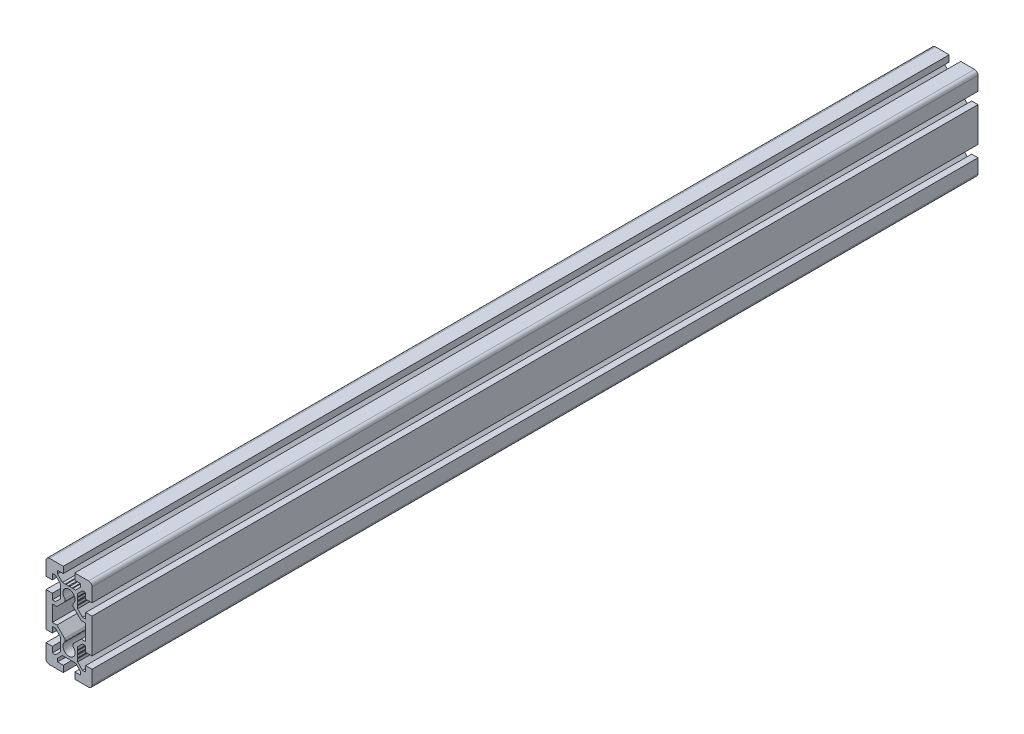
from build123d import *

# Parameters (mm, degrees)
BOSS_EXTRUDE1_DEPTH = 770


with BuildPart() as part:
    # Sketch1 → Boss-Extrude1 (new body)
    with BuildSketch(Plane.XY):
        with BuildLine():
            Line((-14.5, 10), (-14.5, 15))
            Line((-14.5, 15), (-20, 15))
            Line((-20, 15), (-20, -15))
            Line((-20, -15), (-14.5, -15))
            Line((-14.5, -15), (-14.5, -10))
            Line((-14.5, -10), (-11.767766953, -10))
            add(Edge.make_bspline(
                [(-11.767766953, -10), (-10.345177969, -11.422588984), (-8.922588984, -12.845177969), (-7.5, -14.267766953)],
                knots=[0, 0, 0, 0, 1, 1, 1, 1], degree=3))
            Line((-7.5, -14.267766953), (-7.5, -16.653589838))
            Line((-7.5, -16.653589838), (-7.300000072, -16.999999875))
            Line((-7.300000072, -16.999999875), (-7.5, -17.346410162))
            Line((-7.5, -17.346410162), (-7.5, -19.480384758))
            Line((-7.5, -19.480384758), (-7.200000072, -19.999999875))
            Line((-7.200000072, -19.999999875), (-7.5, -20.519615242))
            Line((-7.5, -20.519615242), (-7.5, -22.653589838))
            Line((-7.5, -22.653589838), (-7.3, -23))
            Line((-7.3, -23), (-7.5, -23.346410162))
            Line((-7.5, -23.346410162), (-7.5, -25.732233047))
            add(Edge.make_bspline(
                [(-7.5, -25.732233047), (-8.922588984, -27.154822031), (-10.345177969, -28.577411016), (-11.767766953, -30)],
                knots=[0, 0, 0, 0, 1, 1, 1, 1], degree=3))
            Line((-11.767766953, -30), (-14.5, -30))
            Line((-14.5, -30), (-14.5, -25))
            Line((-14.5, -25), (-20, -25))
            Line((-20, -25), (-20, -37))
            ThreePointArc((-20, -37), (-19.121320344, -39.121320344), (-17, -40))
            Line((-17, -40), (-5, -40))
            Line((-5, -40), (-5, -34.5))
            Line((-5, -34.5), (-10, -34.5))
            Line((-10, -34.5), (-10, -31.767766953))
            add(Edge.make_bspline(
                [(-10, -31.767766953), (-8.577411016, -30.345177969), (-7.154822031, -28.922588984), (-5.732233047, -27.5)],
                knots=[0, 0, 0, 0, 1, 1, 1, 1], degree=3))
            Line((-5.732233047, -27.5), (-3.346410162, -27.5))
            Line((-3.346410162, -27.5), (-3, -27.3))
            Line((-3, -27.3), (-2.653589838, -27.5))
            Line((-2.653589838, -27.5), (-0.519615242, -27.5))
            Line((-0.519615242, -27.5), (-2.17e-07, -27.200000125))
            Line((-2.17e-07, -27.200000125), (0.519615242, -27.5))
            Line((0.519615242, -27.5), (2.653589838, -27.5))
            Line((2.653589838, -27.5), (3, -27.3))
            Line((3, -27.3), (3.346410162, -27.5))
            Line((3.346410162, -27.5), (5.732233047, -27.5))
            add(Edge.make_bspline(
                [(5.732233047, -27.5), (7.154822031, -28.922588984), (8.577411016, -30.345177969), (10, -31.767766953)],
                knots=[0, 0, 0, 0, 1, 1, 1, 1], degree=3))
            Line((10, -31.767766953), (10, -34.5))
            Line((10, -34.5), (5, -34.5))
            Line((5, -34.5), (5, -40))
            Line((5, -40), (17, -40))
            ThreePointArc((17, -40), (19.121320344, -39.121320344), (20, -37))
            Line((20, -37), (20, -25))
            Line((20, -25), (14.5, -25))
            Line((14.5, -25), (14.5, -30))
            Line((14.5, -30), (11.767766953, -30))
            add(Edge.make_bspline(
                [(11.767766953, -30), (10.345177969, -28.577411016), (8.922588984, -27.154822031), (7.5, -25.732233047)],
                knots=[0, 0, 0, 0, 1, 1, 1, 1], degree=3))
            Line((7.5, -25.732233047), (7.5, -23.346410162))
            Line((7.5, -23.346410162), (7.3, -23))
            Line((7.3, -23), (7.5, -22.653589838))
            Line((7.5, -22.653589838), (7.5, -20.519615242))
            Line((7.5, -20.519615242), (7.200000072, -20.000000125))
            Line((7.200000072, -20.000000125), (7.5, -19.480384758))
            Line((7.5, -19.480384758), (7.5, -17.346410162))
            Line((7.5, -17.346410162), (7.300000072, -17.000000125))
            Line((7.300000072, -17.000000125), (7.5, -16.653589838))
            Line((7.5, -16.653589838), (7.5, -14.267766953))
            add(Edge.make_bspline(
                [(7.5, -14.267766953), (8.922588984, -12.845177969), (10.345177969, -11.422588984), (11.767766953, -10)],
                knots=[0, 0, 0, 0, 1, 1, 1, 1], degree=3))
            Line((11.767766953, -10), (14.5, -10))
            Line((14.5, -10), (14.5, -15))
            Line((14.5, -15), (20, -15))
            Line((20, -15), (20, 15))
            Line((20, 15), (14.5, 15))
            Line((14.5, 15), (14.5, 10))
            Line((14.5, 10), (11.767766953, 10))
            add(Edge.make_bspline(
                [(11.767766953, 10), (10.345177969, 11.422588984), (8.922588984, 12.845177969), (7.5, 14.267766953)],
                knots=[0, 0, 0, 0, 1, 1, 1, 1], degree=3))
            Line((7.5, 14.267766953), (7.5, 16.653589838))
            Line((7.5, 16.653589838), (7.300000072, 16.999999875))
            Line((7.300000072, 16.999999875), (7.5, 17.346410162))
            Line((7.5, 17.346410162), (7.5, 19.480384758))
            Line((7.5, 19.480384758), (7.200000072, 19.999999875))
            Line((7.200000072, 19.999999875), (7.5, 20.519615242))
            Line((7.5, 20.519615242), (7.5, 22.653589838))
            Line((7.5, 22.653589838), (7.3, 23))
            Line((7.3, 23), (7.5, 23.346410162))
            Line((7.5, 23.346410162), (7.5, 25.732233047))
            add(Edge.make_bspline(
                [(7.5, 25.732233047), (8.922588984, 27.154822031), (10.345177969, 28.577411016), (11.767766953, 30)],
                knots=[0, 0, 0, 0, 1, 1, 1, 1], degree=3))
            Line((11.767766953, 30), (14.5, 30))
            Line((14.5, 30), (14.5, 25))
            Line((14.5, 25), (20, 25))
            Line((20, 25), (20, 37))
            ThreePointArc((20, 37), (19.121320344, 39.121320344), (17, 40))
            Line((17, 40), (5, 40))
            Line((5, 40), (5, 34.5))
            Line((5, 34.5), (10, 34.5))
            Line((10, 34.5), (10, 31.767766953))
            add(Edge.make_bspline(
                [(10, 31.767766953), (8.577411016, 30.345177969), (7.154822031, 28.922588984), (5.732233047, 27.5)],
                knots=[0, 0, 0, 0, 1, 1, 1, 1], degree=3))
            Line((5.732233047, 27.5), (3.346410162, 27.5))
            Line((3.346410162, 27.5), (3, 27.3))
            Line((3, 27.3), (2.653589838, 27.5))
            Line((2.653589838, 27.5), (0.519615242, 27.5))
            Line((0.519615242, 27.5), (2.17e-07, 27.200000125))
            Line((2.17e-07, 27.200000125), (-0.519615242, 27.5))
            Line((-0.519615242, 27.5), (-2.653589838, 27.5))
            Line((-2.653589838, 27.5), (-3, 27.3))
            Line((-3, 27.3), (-3.346410162, 27.5))
            Line((-3.346410162, 27.5), (-5.732233047, 27.5))
            add(Edge.make_bspline(
                [(-5.732233047, 27.5), (-7.154822031, 28.922588984), (-8.577411016, 30.345177969), (-10, 31.767766953)],
                knots=[0, 0, 0, 0, 1, 1, 1, 1], degree=3))
            Line((-10, 31.767766953), (-10, 34.5))
            Line((-10, 34.5), (-5, 34.5))
            Line((-5, 34.5), (-5, 40))
            Line((-5, 40), (-17, 40))
            ThreePointArc((-17, 40), (-19.121320344, 39.121320344), (-20, 37))
            Line((-20, 37), (-20, 25))
            Line((-20, 25), (-14.5, 25))
            Line((-14.5, 25), (-14.5, 30))
            Line((-14.5, 30), (-11.767766953, 30))
            add(Edge.make_bspline(
                [(-11.767766953, 30), (-10.345177969, 28.577411016), (-8.922588984, 27.154822031), (-7.5, 25.732233047)],
                knots=[0, 0, 0, 0, 1, 1, 1, 1], degree=3))
            Line((-7.5, 25.732233047), (-7.5, 23.346410162))
            Line((-7.5, 23.346410162), (-7.3, 23))
            Line((-7.3, 23), (-7.5, 22.653589838))
            Line((-7.5, 22.653589838), (-7.5, 20.519615242))
            Line((-7.5, 20.519615242), (-7.200000072, 20.000000125))
            Line((-7.200000072, 20.000000125), (-7.5, 19.480384758))
            Line((-7.5, 19.480384758), (-7.5, 17.346410162))
            Line((-7.5, 17.346410162), (-7.300000072, 17.000000125))
            Line((-7.300000072, 17.000000125), (-7.5, 16.653589838))
            Line((-7.5, 16.653589838), (-7.5, 14.267766953))
            add(Edge.make_bspline(
                [(-7.5, 14.267766953), (-8.922588984, 12.845177969), (-10.345177969, 11.422588984), (-11.767766953, 10)],
                knots=[0, 0, 0, 0, 1, 1, 1, 1], degree=3))
            Line((-11.767766953, 10), (-14.5, 10))
        make_face()
        with BuildLine():
            Line((-10.525126266, -7), (-14.5, -7))
            Line((-14.5, -7), (-14.5, 7))
            Line((-14.5, 7), (-10.525126266, 7))
            Line((-10.525126266, 7), (-3.886038516, 13.63908775))
            ThreePointArc((-3.886038516, 13.63908775), (-3.300549454, 15.018813426), (-3.838113574, 16.417907847))
            ThreePointArc((-3.838113574, 16.417907847), (0, 25.25), (3.838113574, 16.417907847))
            ThreePointArc((3.838113574, 16.417907847), (3.300549454, 15.018813426), (3.886038516, 13.63908775))
            add(Edge.make_bspline(
                [(3.886038516, 13.63908775), (6.099067766, 11.4260585), (8.312097016, 9.21302925), (10.525126266, 7)],
                knots=[0, 0, 0, 0, 1, 1, 1, 1], degree=3))
            Line((10.525126266, 7), (14.5, 7))
            Line((14.5, 7), (14.5, -7))
            Line((14.5, -7), (10.525126266, -7))
            add(Edge.make_bspline(
                [(10.525126266, -7), (8.312097016, -9.21302925), (6.099067766, -11.4260585), (3.886038516, -13.63908775)],
                knots=[0, 0, 0, 0, 1, 1, 1, 1], degree=3))
            ThreePointArc((3.886038516, -13.63908775), (3.300549454, -15.018813426), (3.838113574, -16.417907847))
            ThreePointArc((3.838113574, -16.417907847), (0, -25.25), (-3.838113574, -16.417907847))
            ThreePointArc((-3.838113574, -16.417907847), (-3.300549454, -15.018813426), (-3.886038516, -13.63908775))
            add(Edge.make_bspline(
                [(-3.886038516, -13.63908775), (-6.099067766, -11.4260585), (-8.312097016, -9.21302925), (-10.525126266, -7)],
                knots=[0, 0, 0, 0, 1, 1, 1, 1], degree=3))
        make_face(mode=Mode.SUBTRACT)
    extrude(amount=-BOSS_EXTRUDE1_DEPTH)


solid = part.part
